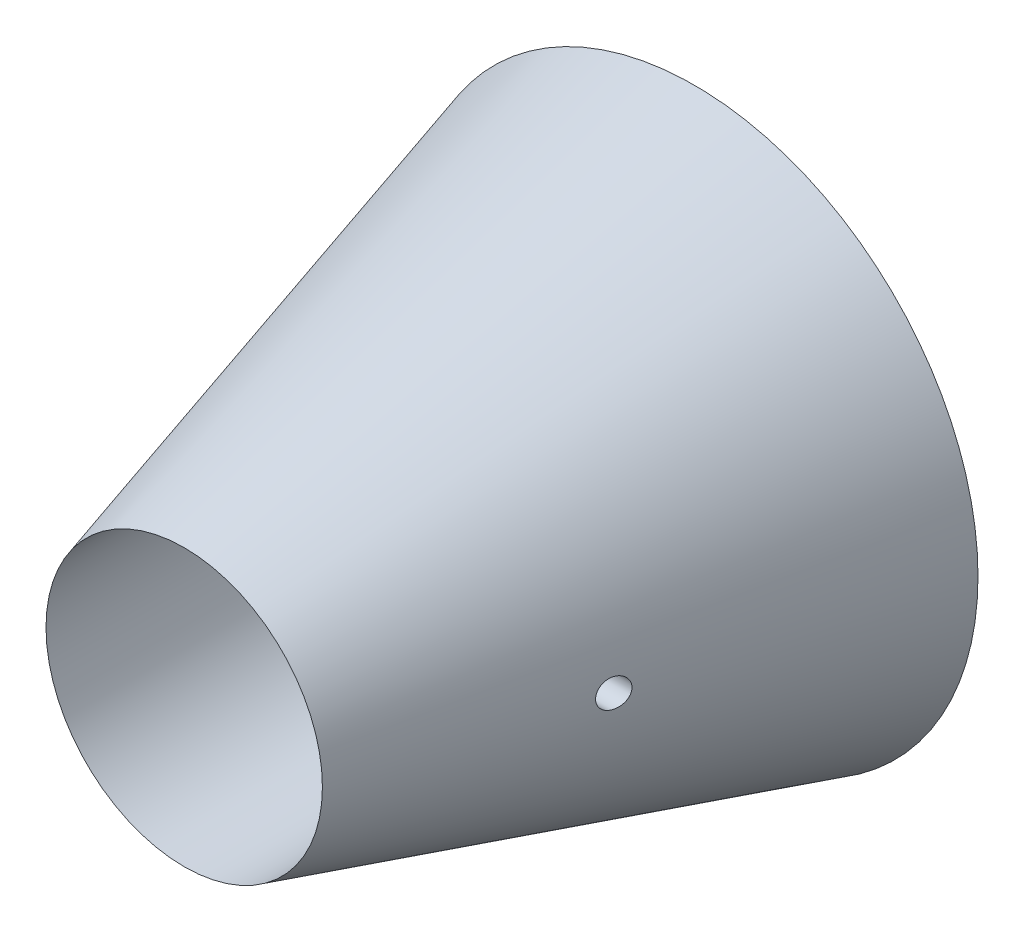
from build123d import *

# Parameters (mm, degrees)
ENL_V_MAT_EXTRU_1_REACH = 230.91
ESQUISSE7_R             = 5


with BuildPart() as part:
    # Esquisse4 → Révolution1 (revolve)
    with BuildSketch(Plane(origin=(0, 0, 0), x_dir=(0, 0, -1), z_dir=(1, 0, 0)), mode=Mode.PRIVATE) as r_volution1_sk:
        Polygon((-180, 48.75), (0, 100), (0, 48.75), align=None)
    revolve(r_volution1_sk.sketch.rotate(Axis((0, 0, 180), (0, 0, -1)), 90), axis=Axis((0, 0, 180), (0, 0, -1)))

    # Enlèv. mat.-Extru.1: up to this cone (the profile starts inside it)
    enl_v_mat_extru_1_end = Plane(origin=(0, 0, 100), z_dir=(0, 0, -1)).offset(-251.219511195) * Cone(1e-06, 157.780895062, 554.157288973, align=(Align.CENTER, Align.CENTER, Align.MIN), mode=Mode.PRIVATE)
    # Esquisse7 → Enlèv. mat.-Extru.1 (cut, up to the surface)
    with BuildSketch(Plane(origin=(0, 0, 0), x_dir=(0, 0, -1), z_dir=(1, 0, 0)), mode=Mode.PRIVATE) as enl_v_mat_extru_1_sk1:
        with Locations(Location((-100, 0, 0), (0, 0, 180))):
            Circle(ESQUISSE7_R)
    enl_v_mat_extru_1_tool1 = extrude(enl_v_mat_extru_1_sk1.sketch, amount=ENL_V_MAT_EXTRU_1_REACH, mode=Mode.PRIVATE) & enl_v_mat_extru_1_end
    add(enl_v_mat_extru_1_tool1.solids().sort_by_distance((0, 0, 100))[0], mode=Mode.SUBTRACT)


solid = part.part
